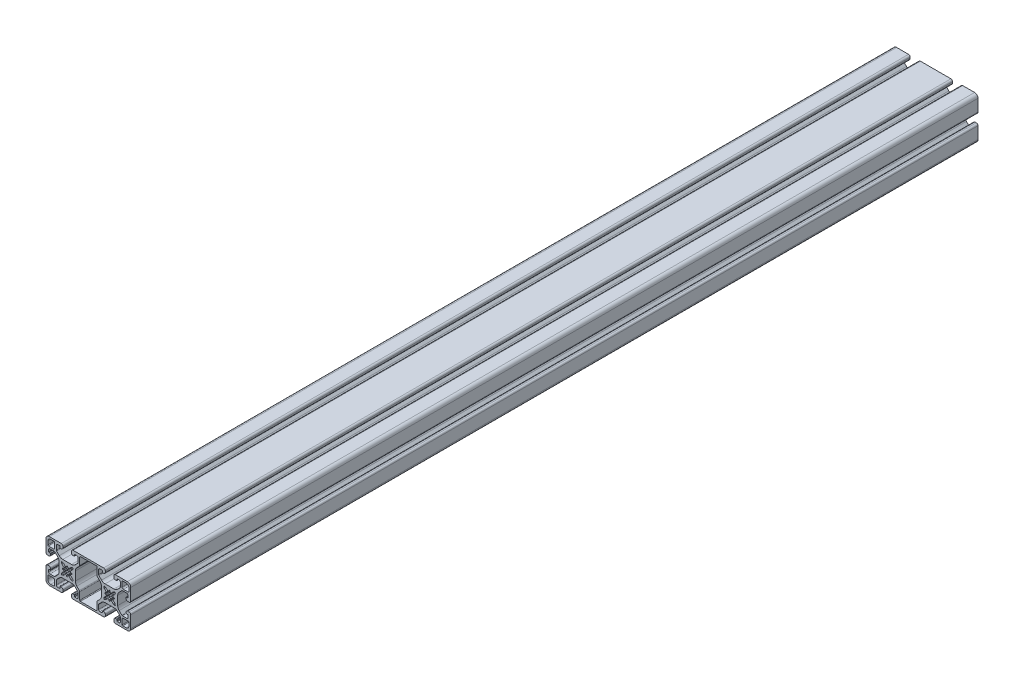
from build123d import *

# Parameters (mm, degrees)
EXTRUDE1_DEPTH = 800


with BuildPart() as part:
    # Sketch1 → Extrude1 (new body)
    with BuildSketch(Plane.XY):
        with BuildLine():
            Line((-44, -18.484793301), (-44, -17.255))
            ThreePointArc((-44, -17.255), (-44.459842354, -16.144842354), (-45.57, -15.685))
            Line((-45.57, -15.685), (-46.474, -15.685))
            ThreePointArc((-46.474, -15.685), (-46.743407684, -15.796592316), (-46.855, -16.066))
            Line((-46.855, -16.066), (-46.855, -17.119))
            ThreePointArc((-46.855, -17.119), (-46.966592316, -17.388407684), (-47.236, -17.5))
            Line((-47.236, -17.5), (-49.015, -17.5))
            ThreePointArc((-49.015, -17.5), (-49.913025612, -17.128025612), (-50.285, -16.23))
            Line((-50.285, -16.23), (-50.285, -12.216214636))
            ThreePointArc((-50.285, -12.216214636), (-50.217252784, -11.875626381), (-50.024325035, -11.5868896))
            Line((-50.024325035, -11.5868896), (-47.513678224, -9.076242789))
            ThreePointArc((-47.513678224, -9.076242789), (-45.972667317, -8.046572221), (-44.154921014, -7.685))
            Line((-44.154921014, -7.685), (-35.845078986, -7.685))
            ThreePointArc((-35.845078986, -7.685), (-34.027332683, -8.046572221), (-32.486321776, -9.076242789))
            Line((-32.486321776, -9.076242789), (-29.975674965, -11.5868896))
            ThreePointArc((-29.975674965, -11.5868896), (-29.782747216, -11.875626381), (-29.715, -12.216214636))
            Line((-29.715, -12.216214636), (-29.715, -16.23))
            ThreePointArc((-29.715, -16.23), (-30.086974388, -17.128025612), (-30.985, -17.5))
            Line((-30.985, -17.5), (-32.764, -17.5))
            ThreePointArc((-32.764, -17.5), (-33.033407684, -17.388407684), (-33.145, -17.119))
            Line((-33.145, -17.119), (-33.145, -16.066))
            ThreePointArc((-33.145, -16.066), (-33.256592316, -15.796592316), (-33.526, -15.685))
            Line((-33.526, -15.685), (-34.43, -15.685))
            ThreePointArc((-34.43, -15.685), (-35.540157646, -16.144842354), (-36, -17.255))
            Line((-36, -17.255), (-36, -18.484793301))
            ThreePointArc((-36, -18.484793301), (-35.521569689, -19.559363866), (-34.43095644, -20))
            Line((-34.43095644, -20), (-5.57, -20))
            ThreePointArc((-5.57, -20), (-4.459842354, -19.540157646), (-4, -18.43))
            Line((-4, -18.43), (-4, -17.255))
            ThreePointArc((-4, -17.255), (-4.459842354, -16.144842354), (-5.57, -15.685))
            Line((-5.57, -15.685), (-6.474, -15.685))
            ThreePointArc((-6.474, -15.685), (-6.743407684, -15.796592316), (-6.855, -16.066))
            Line((-6.855, -16.066), (-6.855, -17.119))
            ThreePointArc((-6.855, -17.119), (-6.966592316, -17.388407684), (-7.236, -17.5))
            Line((-7.236, -17.5), (-9.015, -17.5))
            ThreePointArc((-9.015, -17.5), (-9.913025612, -17.128025612), (-10.285, -16.23))
            Line((-10.285, -16.23), (-10.285, -12.216214636))
            ThreePointArc((-10.285, -12.216214636), (-10.217252784, -11.875626381), (-10.024325035, -11.5868896))
            Line((-10.024325035, -11.5868896), (-7.513678224, -9.076242789))
            ThreePointArc((-7.513678224, -9.076242789), (-5.972667317, -8.046572221), (-4.154921014, -7.685))
            Line((-4.154921014, -7.685), (4.154921014, -7.685))
            ThreePointArc((4.154921014, -7.685), (5.972667317, -8.046572221), (7.513678224, -9.076242789))
            Line((7.513678224, -9.076242789), (10.024325035, -11.5868896))
            ThreePointArc((10.024325035, -11.5868896), (10.217252784, -11.875626381), (10.285, -12.216214636))
            Line((10.285, -12.216214636), (10.285, -16.23))
            ThreePointArc((10.285, -16.23), (9.913025612, -17.128025612), (9.015, -17.5))
            Line((9.015, -17.5), (7.236, -17.5))
            ThreePointArc((7.236, -17.5), (6.966592316, -17.388407684), (6.855, -17.119))
            Line((6.855, -17.119), (6.855, -16.066))
            ThreePointArc((6.855, -16.066), (6.743407684, -15.796592316), (6.474, -15.685))
            Line((6.474, -15.685), (5.57, -15.685))
            ThreePointArc((5.57, -15.685), (4.459842354, -16.144842354), (4, -17.255))
            Line((4, -17.255), (4, -18.43))
            ThreePointArc((4, -18.43), (4.459842354, -19.540157646), (5.57, -20))
            Line((5.57, -20), (16.83, -20))
            ThreePointArc((16.83, -20), (19.071528496, -19.071528496), (20, -16.83))
            Line((20, -16.83), (20, -5.57))
            ThreePointArc((20, -5.57), (19.540157646, -4.459842354), (18.43, -4))
            Line((18.43, -4), (17.255, -4))
            ThreePointArc((17.255, -4), (16.144842354, -4.459842354), (15.685, -5.57))
            Line((15.685, -5.57), (15.685, -6.474))
            ThreePointArc((15.685, -6.474), (15.796592316, -6.743407684), (16.066, -6.855))
            Line((16.066, -6.855), (17.119, -6.855))
            ThreePointArc((17.119, -6.855), (17.388407684, -6.966592316), (17.5, -7.236))
            Line((17.5, -7.236), (17.5, -9.015))
            ThreePointArc((17.5, -9.015), (17.128025612, -9.913025612), (16.23, -10.285))
            Line((16.23, -10.285), (12.216214636, -10.285))
            ThreePointArc((12.216214636, -10.285), (11.875626381, -10.217252784), (11.5868896, -10.024325035))
            Line((11.5868896, -10.024325035), (9.076242789, -7.513678224))
            ThreePointArc((9.076242789, -7.513678224), (8.046572221, -5.972667317), (7.685, -4.154921014))
            Line((7.685, -4.154921014), (7.685, 4.154921014))
            ThreePointArc((7.685, 4.154921014), (8.046572221, 5.972667317), (9.076242789, 7.513678224))
            Line((9.076242789, 7.513678224), (11.5868896, 10.024325035))
            ThreePointArc((11.5868896, 10.024325035), (11.875626381, 10.217252784), (12.216214636, 10.285))
            Line((12.216214636, 10.285), (16.23, 10.285))
            ThreePointArc((16.23, 10.285), (17.128025612, 9.913025612), (17.5, 9.015))
            Line((17.5, 9.015), (17.5, 7.236))
            ThreePointArc((17.5, 7.236), (17.388407684, 6.966592316), (17.119, 6.855))
            Line((17.119, 6.855), (16.066, 6.855))
            ThreePointArc((16.066, 6.855), (15.796592316, 6.743407684), (15.685, 6.474))
            Line((15.685, 6.474), (15.685, 5.57))
            ThreePointArc((15.685, 5.57), (16.144842354, 4.459842354), (17.255, 4))
            Line((17.255, 4), (18.43, 4))
            ThreePointArc((18.43, 4), (19.540157646, 4.459842354), (20, 5.57))
            Line((20, 5.57), (20, 16.83))
            ThreePointArc((20, 16.83), (19.071528496, 19.071528496), (16.83, 20))
            Line((16.83, 20), (5.57, 20))
            ThreePointArc((5.57, 20), (4.459842354, 19.540157646), (4, 18.43))
            Line((4, 18.43), (4, 17.255))
            ThreePointArc((4, 17.255), (4.459842354, 16.144842354), (5.57, 15.685))
            Line((5.57, 15.685), (6.474, 15.685))
            ThreePointArc((6.474, 15.685), (6.743407684, 15.796592316), (6.855, 16.066))
            Line((6.855, 16.066), (6.855, 17.119))
            ThreePointArc((6.855, 17.119), (6.966592316, 17.388407684), (7.236, 17.5))
            Line((7.236, 17.5), (9.015, 17.5))
            ThreePointArc((9.015, 17.5), (9.913025612, 17.128025612), (10.285, 16.23))
            Line((10.285, 16.23), (10.285, 12.216214636))
            ThreePointArc((10.285, 12.216214636), (10.217252784, 11.875626381), (10.024325035, 11.5868896))
            Line((10.024325035, 11.5868896), (7.513678224, 9.076242789))
            ThreePointArc((7.513678224, 9.076242789), (5.972667317, 8.046572221), (4.154921014, 7.685))
            Line((4.154921014, 7.685), (-4.154921014, 7.685))
            ThreePointArc((-4.154921014, 7.685), (-5.972667317, 8.046572221), (-7.513678224, 9.076242789))
            Line((-7.513678224, 9.076242789), (-10.024325035, 11.5868896))
            ThreePointArc((-10.024325035, 11.5868896), (-10.217252784, 11.875626381), (-10.285, 12.216214636))
            Line((-10.285, 12.216214636), (-10.285, 16.23))
            ThreePointArc((-10.285, 16.23), (-9.913025612, 17.128025612), (-9.015, 17.5))
            Line((-9.015, 17.5), (-7.236, 17.5))
            ThreePointArc((-7.236, 17.5), (-6.966592316, 17.388407684), (-6.855, 17.119))
            Line((-6.855, 17.119), (-6.855, 16.066))
            ThreePointArc((-6.855, 16.066), (-6.743407684, 15.796592316), (-6.474, 15.685))
            Line((-6.474, 15.685), (-5.57, 15.685))
            ThreePointArc((-5.57, 15.685), (-4.459842354, 16.144842354), (-4, 17.255))
            Line((-4, 17.255), (-4, 18.43))
            ThreePointArc((-4, 18.43), (-4.459842354, 19.540157646), (-5.57, 20))
            Line((-5.57, 20), (-34.43, 20))
            ThreePointArc((-34.43, 20), (-35.540157646, 19.540157646), (-36, 18.43))
            Line((-36, 18.43), (-36, 17.255))
            ThreePointArc((-36, 17.255), (-35.540157646, 16.144842354), (-34.43, 15.685))
            Line((-34.43, 15.685), (-33.526, 15.685))
            ThreePointArc((-33.526, 15.685), (-33.256592316, 15.796592316), (-33.145, 16.066))
            Line((-33.145, 16.066), (-33.145, 17.119))
            ThreePointArc((-33.145, 17.119), (-33.033407684, 17.388407684), (-32.764, 17.5))
            Line((-32.764, 17.5), (-30.985, 17.5))
            ThreePointArc((-30.985, 17.5), (-30.086974388, 17.128025612), (-29.715, 16.23))
            Line((-29.715, 16.23), (-29.715, 12.216214636))
            ThreePointArc((-29.715, 12.216214636), (-29.782747216, 11.875626381), (-29.975674965, 11.5868896))
            Line((-29.975674965, 11.5868896), (-32.486321776, 9.076242789))
            ThreePointArc((-32.486321776, 9.076242789), (-34.027332683, 8.046572221), (-35.845078986, 7.685))
            Line((-35.845078986, 7.685), (-44.154921014, 7.685))
            ThreePointArc((-44.154921014, 7.685), (-45.972667317, 8.046572221), (-47.513678224, 9.076242789))
            Line((-47.513678224, 9.076242789), (-50.024325035, 11.5868896))
            ThreePointArc((-50.024325035, 11.5868896), (-50.217252784, 11.875626381), (-50.285, 12.216214636))
            Line((-50.285, 12.216214636), (-50.285, 16.23))
            ThreePointArc((-50.285, 16.23), (-49.913025612, 17.128025612), (-49.015, 17.5))
            Line((-49.015, 17.5), (-47.236, 17.5))
            ThreePointArc((-47.236, 17.5), (-46.966592316, 17.388407684), (-46.855, 17.119))
            Line((-46.855, 17.119), (-46.855, 16.066))
            ThreePointArc((-46.855, 16.066), (-46.743407684, 15.796592316), (-46.474, 15.685))
            Line((-46.474, 15.685), (-45.57, 15.685))
            ThreePointArc((-45.57, 15.685), (-44.459842354, 16.144842354), (-44, 17.255))
            Line((-44, 17.255), (-44, 18.43))
            ThreePointArc((-44, 18.43), (-44.459842354, 19.540157646), (-45.57, 20))
            Line((-45.57, 20), (-56.83, 20))
            ThreePointArc((-56.83, 20), (-59.071528496, 19.071528496), (-60, 16.83))
            Line((-60, 16.83), (-60, 5.57))
            ThreePointArc((-60, 5.57), (-59.540157646, 4.459842354), (-58.43, 4))
            Line((-58.43, 4), (-57.255, 4))
            ThreePointArc((-57.255, 4), (-56.144842354, 4.459842354), (-55.685, 5.57))
            Line((-55.685, 5.57), (-55.685, 6.474))
            ThreePointArc((-55.685, 6.474), (-55.796592316, 6.743407684), (-56.066, 6.855))
            Line((-56.066, 6.855), (-57.119, 6.855))
            ThreePointArc((-57.119, 6.855), (-57.388407684, 6.966592316), (-57.5, 7.236))
            Line((-57.5, 7.236), (-57.5, 9.015))
            ThreePointArc((-57.5, 9.015), (-57.128025612, 9.913025612), (-56.23, 10.285))
            Line((-56.23, 10.285), (-52.216214636, 10.285))
            ThreePointArc((-52.216214636, 10.285), (-51.875626381, 10.217252784), (-51.5868896, 10.024325035))
            Line((-51.5868896, 10.024325035), (-49.076242789, 7.513678224))
            ThreePointArc((-49.076242789, 7.513678224), (-48.046572221, 5.972667317), (-47.685, 4.154921014))
            Line((-47.685, 4.154921014), (-47.685, -4.154921014))
            ThreePointArc((-47.685, -4.154921014), (-48.046572221, -5.972667317), (-49.076242789, -7.513678224))
            Line((-49.076242789, -7.513678224), (-51.5868896, -10.024325035))
            ThreePointArc((-51.5868896, -10.024325035), (-51.875626381, -10.217252784), (-52.216214636, -10.285))
            Line((-52.216214636, -10.285), (-56.23, -10.285))
            ThreePointArc((-56.23, -10.285), (-57.128025612, -9.913025612), (-57.5, -9.015))
            Line((-57.5, -9.015), (-57.5, -7.236))
            ThreePointArc((-57.5, -7.236), (-57.388407684, -6.966592316), (-57.119, -6.855))
            Line((-57.119, -6.855), (-56.066, -6.855))
            ThreePointArc((-56.066, -6.855), (-55.796592316, -6.743407684), (-55.685, -6.474))
            Line((-55.685, -6.474), (-55.685, -5.57))
            ThreePointArc((-55.685, -5.57), (-56.144842354, -4.459842354), (-57.255, -4))
            Line((-57.255, -4), (-58.43, -4))
            ThreePointArc((-58.43, -4), (-59.540157646, -4.459842354), (-60, -5.57))
            Line((-60, -5.57), (-60, -16.83))
            ThreePointArc((-60, -16.83), (-59.071528496, -19.071528496), (-56.83, -20))
            Line((-56.83, -20), (-45.56904356, -20))
            ThreePointArc((-45.56904356, -20), (-44.478430311, -19.559363866), (-44, -18.484793301))
        make_face()
        with BuildLine():
            Line((15.545, -18.345), (12.4898, -18.345))
            ThreePointArc((12.4898, -18.345), (12.044322728, -18.160477272), (11.8598, -17.715))
            Line((11.8598, -17.715), (11.8598, -13.1298))
            ThreePointArc((11.8598, -13.1298), (12.231774388, -12.231774388), (13.1298, -11.8598))
            Line((13.1298, -11.8598), (17.715, -11.8598))
            ThreePointArc((17.715, -11.8598), (18.160477272, -12.044322728), (18.345, -12.4898))
            Line((18.345, -12.4898), (18.345, -15.545))
            ThreePointArc((18.345, -15.545), (17.524898987, -17.524898987), (15.545, -18.345))
        make_face(mode=Mode.SUBTRACT)
        with BuildLine():
            Line((-11.8598, 17.715), (-11.8598, 10.823286659))
            ThreePointArc((-11.8598, 10.823286659), (-11.763127006, 10.3372787), (-11.487825612, 9.925261047))
            Line((-11.487825612, 9.925261047), (-9.076242789, 7.513678224))
            ThreePointArc((-9.076242789, 7.513678224), (-8.046572221, 5.972667317), (-7.685, 4.154921014))
            Line((-7.685, 4.154921014), (-7.685, -4.154921014))
            ThreePointArc((-7.685, -4.154921014), (-8.046572221, -5.972667317), (-9.076242789, -7.513678224))
            Line((-9.076242789, -7.513678224), (-11.487825612, -9.925261047))
            ThreePointArc((-11.487825612, -9.925261047), (-11.763127006, -10.3372787), (-11.8598, -10.823286659))
            Line((-11.8598, -10.823286659), (-11.8598, -17.715))
            ThreePointArc((-11.8598, -17.715), (-12.044322728, -18.160477272), (-12.4898, -18.345))
            Line((-12.4898, -18.345), (-27.5102, -18.345))
            ThreePointArc((-27.5102, -18.345), (-27.955677272, -18.160477272), (-28.1402, -17.715))
            Line((-28.1402, -17.715), (-28.1402, -10.823286659))
            ThreePointArc((-28.1402, -10.823286659), (-28.236872994, -10.3372787), (-28.512174388, -9.925261047))
            Line((-28.512174388, -9.925261047), (-30.923757211, -7.513678224))
            ThreePointArc((-30.923757211, -7.513678224), (-31.953427779, -5.972667317), (-32.315, -4.154921014))
            Line((-32.315, -4.154921014), (-32.315, 4.154921014))
            ThreePointArc((-32.315, 4.154921014), (-31.953427779, 5.972667317), (-30.923757211, 7.513678224))
            Line((-30.923757211, 7.513678224), (-28.512174388, 9.925261047))
            ThreePointArc((-28.512174388, 9.925261047), (-28.236872994, 10.3372787), (-28.1402, 10.823286659))
            Line((-28.1402, 10.823286659), (-28.1402, 17.715))
            ThreePointArc((-28.1402, 17.715), (-27.955677272, 18.160477272), (-27.5102, 18.345))
            Line((-27.5102, 18.345), (-12.4898, 18.345))
            ThreePointArc((-12.4898, 18.345), (-12.044322728, 18.160477272), (-11.8598, 17.715))
        make_face(mode=Mode.SUBTRACT)
        with BuildLine():
            Line((-58.345, -15.545), (-58.345, -12.4898))
            ThreePointArc((-58.345, -12.4898), (-58.160477272, -12.044322728), (-57.715, -11.8598))
            Line((-57.715, -11.8598), (-53.1298, -11.8598))
            ThreePointArc((-53.1298, -11.8598), (-52.231774388, -12.231774388), (-51.8598, -13.1298))
            Line((-51.8598, -13.1298), (-51.8598, -17.715))
            ThreePointArc((-51.8598, -17.715), (-52.044322728, -18.160477272), (-52.4898, -18.345))
            Line((-52.4898, -18.345), (-55.545, -18.345))
            ThreePointArc((-55.545, -18.345), (-57.524898987, -17.524898987), (-58.345, -15.545))
        make_face(mode=Mode.SUBTRACT)
        with BuildLine():
            Line((-55.545, 18.345), (-52.4898, 18.345))
            ThreePointArc((-52.4898, 18.345), (-52.044322728, 18.160477272), (-51.8598, 17.715))
            Line((-51.8598, 17.715), (-51.8598, 13.1298))
            ThreePointArc((-51.8598, 13.1298), (-52.231774388, 12.231774388), (-53.1298, 11.8598))
            Line((-53.1298, 11.8598), (-57.715, 11.8598))
            ThreePointArc((-57.715, 11.8598), (-58.160477272, 12.044322728), (-58.345, 12.4898))
            Line((-58.345, 12.4898), (-58.345, 15.545))
            ThreePointArc((-58.345, 15.545), (-57.524898987, 17.524898987), (-55.545, 18.345))
        make_face(mode=Mode.SUBTRACT)
        with BuildLine():
            Line((18.345, 15.545), (18.345, 12.4898))
            ThreePointArc((18.345, 12.4898), (18.160477272, 12.044322728), (17.715, 11.8598))
            Line((17.715, 11.8598), (13.1298, 11.8598))
            ThreePointArc((13.1298, 11.8598), (12.231774388, 12.231774388), (11.8598, 13.1298))
            Line((11.8598, 13.1298), (11.8598, 17.715))
            ThreePointArc((11.8598, 17.715), (12.044322728, 18.160477272), (12.4898, 18.345))
            Line((12.4898, 18.345), (15.545, 18.345))
            ThreePointArc((15.545, 18.345), (17.524898987, 17.524898987), (18.345, 15.545))
        make_face(mode=Mode.SUBTRACT)
        with BuildLine():
            Line((-34.873747818, -3.712038616), (-34.560690261, -4.84811685))
            ThreePointArc((-34.560690261, -4.84811685), (-34.696699139, -5.303300857), (-35.151883146, -5.43930974))
            Line((-35.151883146, -5.43930974), (-36.28796138, -5.126252183))
            Line((-36.28796138, -5.126252183), (-38.409281723, -3.00493184))
            ThreePointArc((-38.409281723, -3.00493184), (-38.879390357, -3.210020877), (-39.375, -3.34206149))
            Line((-39.375, -3.34206149), (-39.507740766, -4.087640441))
            ThreePointArc((-39.507740766, -4.087640441), (-40, -4.5), (-40.492259234, -4.087640441))
            Line((-40.492259234, -4.087640441), (-40.625, -3.34206149))
            ThreePointArc((-40.625, -3.34206149), (-41.120609643, -3.210020877), (-41.590718277, -3.00493184))
            Line((-41.590718277, -3.00493184), (-43.71203862, -5.126252183))
            Line((-43.71203862, -5.126252183), (-44.848116854, -5.43930974))
            ThreePointArc((-44.848116854, -5.43930974), (-45.303300871, -5.303300847), (-45.439309734, -4.848116822))
            Line((-45.439309734, -4.848116822), (-45.126252208, -3.712038579))
            Line((-45.126252208, -3.712038579), (-43.004931858, -1.590718243))
            ThreePointArc((-43.004931858, -1.590718243), (-43.210020883, -1.120609625), (-43.34206149, -0.625))
            Line((-43.34206149, -0.625), (-44.087640441, -0.492259234))
            ThreePointArc((-44.087640441, -0.492259234), (-44.5, 0), (-44.087640441, 0.492259234))
            Line((-44.087640441, 0.492259234), (-43.34206149, 0.625))
            ThreePointArc((-43.34206149, 0.625), (-43.210020877, 1.120609643), (-43.00493184, 1.590718277))
            Line((-43.00493184, 1.590718277), (-45.126252183, 3.71203862))
            Line((-45.126252183, 3.71203862), (-45.43930974, 4.848116854))
            ThreePointArc((-45.43930974, 4.848116854), (-45.303300847, 5.303300871), (-44.848116822, 5.439309734))
            Line((-44.848116822, 5.439309734), (-43.712038579, 5.126252209))
            Line((-43.712038579, 5.126252209), (-41.590718243, 3.004931858))
            ThreePointArc((-41.590718243, 3.004931858), (-41.120609625, 3.210020883), (-40.625, 3.34206149))
            Line((-40.625, 3.34206149), (-40.492259234, 4.087640441))
            ThreePointArc((-40.492259234, 4.087640441), (-40, 4.5), (-39.507740766, 4.087640441))
            Line((-39.507740766, 4.087640441), (-39.375, 3.34206149))
            ThreePointArc((-39.375, 3.34206149), (-38.879390364, 3.210020879), (-38.409281735, 3.004931846))
            Line((-38.409281735, 3.004931846), (-36.287961384, 5.126252182))
            Line((-36.287961384, 5.126252182), (-35.15188315, 5.43930974))
            ThreePointArc((-35.15188315, 5.43930974), (-34.696699143, 5.303300861), (-34.56069026, 4.848116854))
            Line((-34.56069026, 4.848116854), (-34.873747817, 3.71203862))
            Line((-34.873747817, 3.71203862), (-36.99506816, 1.590718277))
            ThreePointArc((-36.99506816, 1.590718277), (-36.789979123, 1.120609643), (-36.65793851, 0.625))
            Line((-36.65793851, 0.625), (-35.912359559, 0.492259234))
            ThreePointArc((-35.912359559, 0.492259234), (-35.5, 0), (-35.912359559, -0.492259234))
            Line((-35.912359559, -0.492259234), (-36.65793851, -0.625))
            ThreePointArc((-36.65793851, -0.625), (-36.789979121, -1.120609636), (-36.995068154, -1.590718265))
            Line((-36.995068154, -1.590718265), (-34.873747818, -3.712038616))
        make_face(mode=Mode.SUBTRACT)
        with BuildLine():
            Line((5.126252183, -3.712038621), (5.43930974, -4.848116855))
            ThreePointArc((5.43930974, -4.848116855), (5.303300859, -5.303300859), (4.848116855, -5.439309741))
            Line((4.848116855, -5.439309741), (3.712038621, -5.126252182))
            Line((3.712038621, -5.126252182), (1.590718278, -3.00493184))
            ThreePointArc((1.590718278, -3.00493184), (1.120609643, -3.210020877), (0.625, -3.34206149))
            Line((0.625, -3.34206149), (0.492259234, -4.087640441))
            ThreePointArc((0.492259234, -4.087640441), (0, -4.5), (-0.492259234, -4.087640441))
            Line((-0.492259234, -4.087640441), (-0.625, -3.34206149))
            ThreePointArc((-0.625, -3.34206149), (-1.120609643, -3.210020877), (-1.590718277, -3.00493184))
            Line((-1.590718277, -3.00493184), (-3.71203862, -5.126252183))
            Line((-3.71203862, -5.126252183), (-4.848116854, -5.43930974))
            ThreePointArc((-4.848116854, -5.43930974), (-5.30330086, -5.30330086), (-5.439309742, -4.848116855))
            Line((-5.439309742, -4.848116855), (-5.126252183, -3.712038621))
            Line((-5.126252183, -3.712038621), (-3.004931839, -1.590718279))
            ThreePointArc((-3.004931839, -1.590718279), (-3.210020876, -1.120609644), (-3.34206149, -0.625))
            Line((-3.34206149, -0.625), (-4.087640441, -0.492259234))
            ThreePointArc((-4.087640441, -0.492259234), (-4.5, 0), (-4.087640441, 0.492259234))
            Line((-4.087640441, 0.492259234), (-3.34206149, 0.625))
            ThreePointArc((-3.34206149, 0.625), (-3.210020877, 1.120609643), (-3.00493184, 1.590718277))
            Line((-3.00493184, 1.590718277), (-5.126252183, 3.71203862))
            Line((-5.126252183, 3.71203862), (-5.439309741, 4.848116854))
            ThreePointArc((-5.439309741, 4.848116854), (-5.303300859, 5.303300859), (-4.848116854, 5.43930974))
            Line((-4.848116854, 5.43930974), (-3.712038621, 5.126252183))
            Line((-3.712038621, 5.126252183), (-1.590718277, 3.00493184))
            ThreePointArc((-1.590718277, 3.00493184), (-1.120609643, 3.210020877), (-0.625, 3.34206149))
            Line((-0.625, 3.34206149), (-0.492259234, 4.087640441))
            ThreePointArc((-0.492259234, 4.087640441), (0, 4.5), (0.492259234, 4.087640441))
            Line((0.492259234, 4.087640441), (0.625, 3.34206149))
            ThreePointArc((0.625, 3.34206149), (1.120609646, 3.210020876), (1.590718283, 3.004931837))
            Line((1.590718283, 3.004931837), (3.712038628, 5.126252178))
            Line((3.712038628, 5.126252178), (4.84811686, 5.439309741))
            ThreePointArc((4.84811686, 5.439309741), (5.303300861, 5.303300856), (5.43930974, 4.848116854))
            Line((5.43930974, 4.848116854), (5.126252183, 3.71203862))
            Line((5.126252183, 3.71203862), (3.00493184, 1.590718277))
            ThreePointArc((3.00493184, 1.590718277), (3.210020877, 1.120609643), (3.34206149, 0.625))
            Line((3.34206149, 0.625), (4.087640441, 0.492259234))
            ThreePointArc((4.087640441, 0.492259234), (4.5, 0), (4.087640441, -0.492259234))
            Line((4.087640441, -0.492259234), (3.34206149, -0.625))
            ThreePointArc((3.34206149, -0.625), (3.210020877, -1.120609643), (3.00493184, -1.590718278))
            Line((3.00493184, -1.590718278), (5.126252183, -3.712038621))
        make_face(mode=Mode.SUBTRACT)
    extrude(amount=-EXTRUDE1_DEPTH)


solid = part.part
